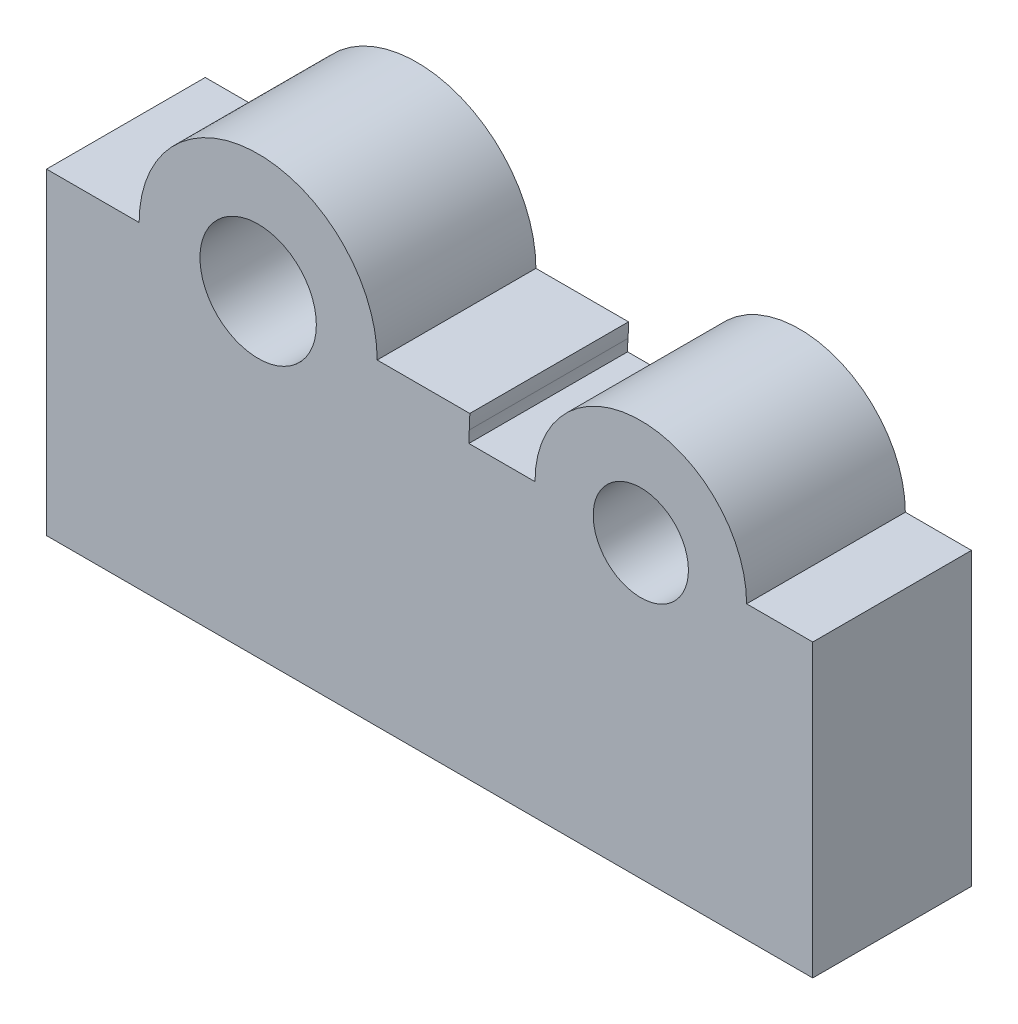
from build123d import *
from build123d.topology import SkipClean

# Parameters (mm, degrees)
BOSS_EXTRUDE2_DEPTH = 30
SKETCH3_R           = 20
SKETCH3_R_2         = 11.2
BOSS_EXTRUDE3_DEPTH = 30
BOSS_EXTRUDE5_START = 7
SKETCH3_7_R         = 11.2
SKETCH3_7_R_2       = 9
BOSS_EXTRUDE5_DEPTH = 23
BOSS_EXTRUDE6_START = 30
SKETCH4_R           = 22.5
BOSS_EXTRUDE6_DEPTH = 30
SKETCH4_3_R         = 13.2
CUT_EXTRUDE3_DEPTH  = 10.2
SKETCH4_5_R         = 11
CUT_EXTRUDE5_DEPTH  = 129.617418947


with BuildPart() as part:
    # Sketch1 → Boss-Extrude2 (new body)
    with BuildSketch(Plane.XY):
        with BuildLine():
            ThreePointArc((-32.422618907, 2.241379763), (-73.707512578, -34.97618336), (-112.327380707, 5))
            Line((-112.327380707, 5), (-112.327380707, -55))
            Line((-112.327380707, -55), (-32.5, -55))
            Line((-32.5, -55), (-32.5, 0))
            ThreePointArc((-32.5, 0), (-32.480648966, 1.121357556), (-32.422618907, 2.241379763))
        make_face()
        with BuildLine():
            Line((-32.327380707, 5), (-62.327380707, 5))
            ThreePointArc((-62.327380707, 5), (-72.327380707, -5), (-82.327380707, 5))
            Line((-82.327380707, 5), (-112.327380707, 5))
            ThreePointArc((-112.327380707, 5), (-73.707512578, -34.97618336), (-32.422618907, 2.241379763))
            ThreePointArc((-32.422618907, 2.241379763), (-32.351197348, 3.619868129), (-32.327380707, 5))
        make_face()
        with BuildLine():
            Line((32.5, -55), (32.5, 0))
            ThreePointArc((32.5, 0), (0, -32.5), (-32.5, 0))
            Line((-32.5, 0), (-32.5, -55))
            Line((-32.5, -55), (-32.327380707, -55))
            Line((-32.327380707, -55), (32.5, -55))
        make_face()
        with BuildLine():
            ThreePointArc((-32.5, 0), (0, -32.5), (32.5, 0))
            Line((32.5, 0), (11.2, 0))
            ThreePointArc((11.2, 0), (0, -11.2), (-11.2, 0))
            Line((-11.2, 0), (-32.5, 0))
        make_face()
    extrude(amount=BOSS_EXTRUDE2_DEPTH)

    # Sketch3 → Boss-Extrude3 (add)
    with SkipClean():  # the faces are left unmerged after this step: merging them gives an invalid solid
        with BuildSketch(Plane.XY):
            Circle(SKETCH3_R)
            Circle(SKETCH3_R_2, mode=Mode.SUBTRACT)
        extrude(amount=BOSS_EXTRUDE3_DEPTH)

    # Sketch3<7> → Boss-Extrude5 (add)
    with SkipClean():  # the faces are left unmerged after this step: merging them gives an invalid solid
        with BuildSketch(Plane.XY.offset(BOSS_EXTRUDE5_START)):
            Circle(SKETCH3_7_R)
            Circle(SKETCH3_7_R_2, mode=Mode.SUBTRACT)
        extrude(amount=BOSS_EXTRUDE5_DEPTH)

    # Sketch4 → Boss-Extrude6 (add)
    with SkipClean():  # the faces are left unmerged after this step: merging them gives an invalid solid
        with BuildSketch(Plane.XY.offset(BOSS_EXTRUDE6_START)):
            with Locations((-72.327380707, 5)):
                Circle(SKETCH4_R)
        extrude(amount=-BOSS_EXTRUDE6_DEPTH)

    # Sketch4<3> → Cut-Extrude3 (cut)
    with SkipClean():  # the faces are left unmerged after this step: merging them gives an invalid solid
        with BuildSketch(Plane.XY):
            with Locations((-72.327380707, 5)):
                Circle(SKETCH4_3_R)
        extrude(amount=CUT_EXTRUDE3_DEPTH, mode=Mode.SUBTRACT)

    # Sketch4<5> → Cut-Extrude5 (cut, through all)
    with SkipClean():  # the faces are left unmerged after this step: merging them gives an invalid solid
        with BuildSketch(Plane.XY):
            with Locations((-72.327380707, 5)):
                Circle(SKETCH4_5_R)
        extrude(amount=CUT_EXTRUDE5_DEPTH, mode=Mode.SUBTRACT)


solid = part.part
